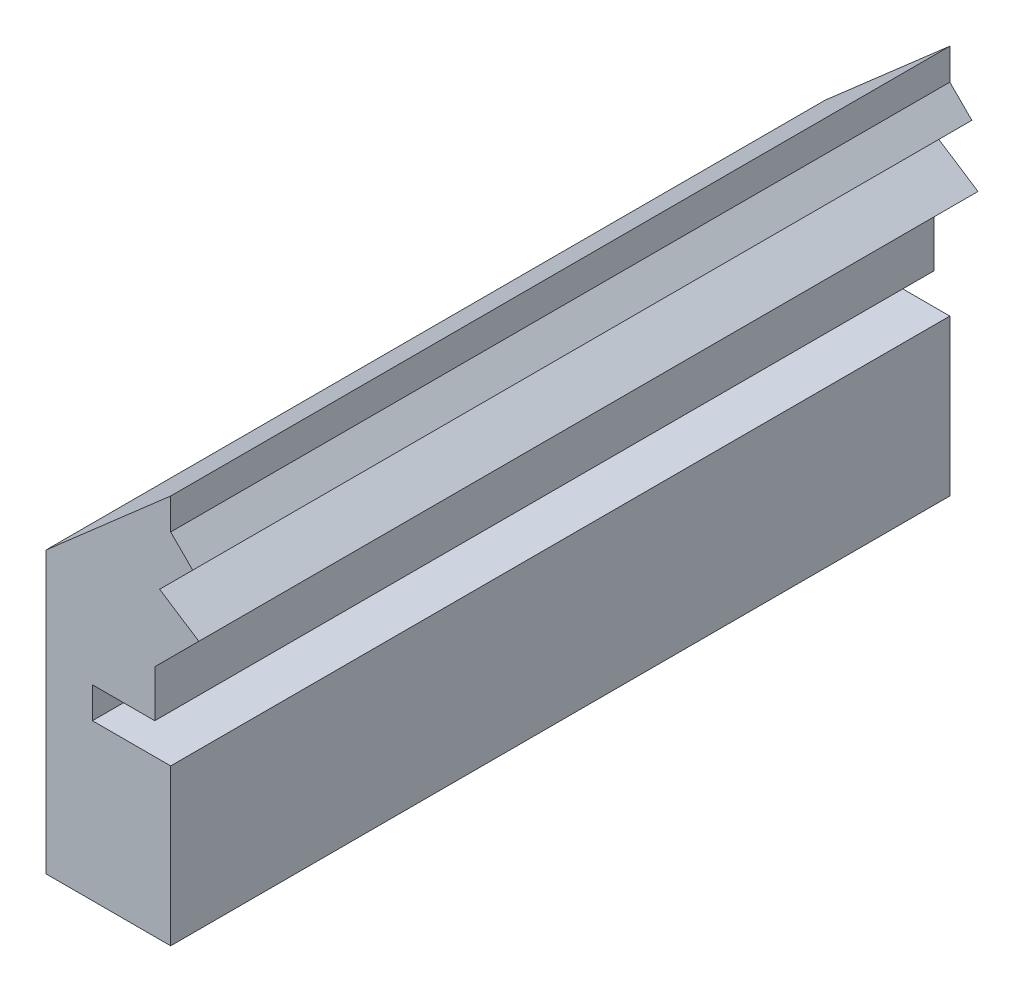
from build123d import *

# Parameters (mm, degrees)
BOSS_EXTRUDE1_DEPTH = 250


with BuildPart() as part:
    # Sketch1 → Boss-Extrude1 (new body)
    with BuildSketch(Plane.XY):
        Polygon((0, 0), (0, -10), (7.071067812, -17.071067812), (-3.535533906, -27.67766953), (9.037628476, -35.857864376), (-5.104507148, -50), (-5.104507148, -65), (-25.104507148, -65), (-25.104507148, -75), (0, -75), (0, -125), (-40, -125), (-40, -35), align=None)
    extrude(amount=BOSS_EXTRUDE1_DEPTH)


solid = part.part
